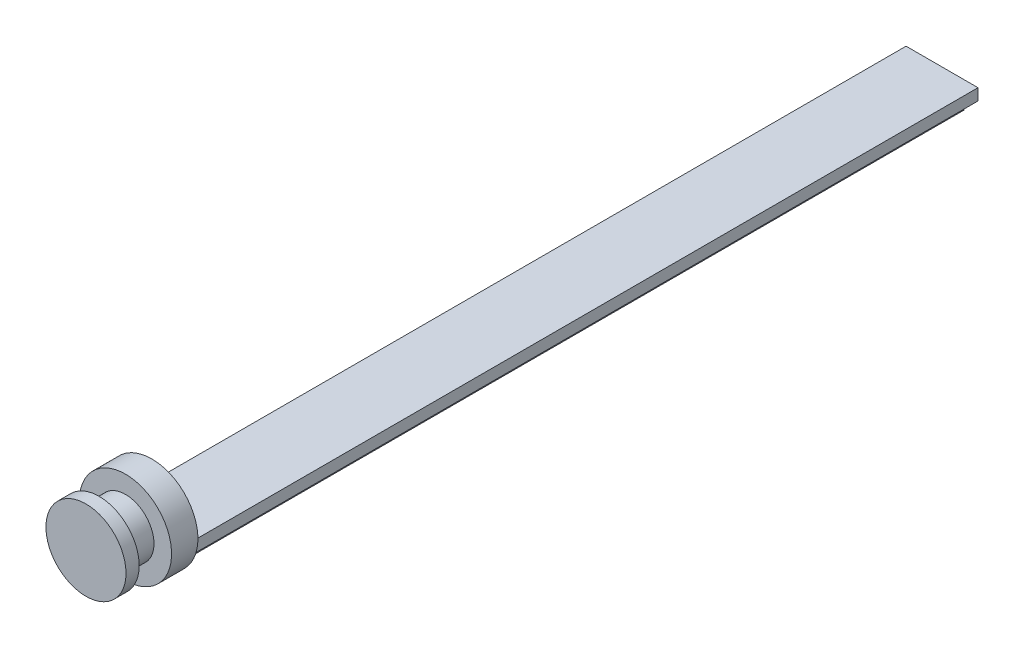
from build123d import *

# Parameters (mm, degrees)
CROQUIS1_R              = 4.56
SALIENTE_EXTRUIR4_DEPTH = 1.5
CROQUIS4_R              = 3.25
SALIENTE_EXTRUIR5_DEPTH = 3
CROQUIS5_R              = 5.25
SALIENTE_EXTRUIR6_DEPTH = 3
CROQUIS6_W              = 2.5
CROQUIS6_H              = 1.700541123
SALIENTE_EXTRUIR7_DEPTH = 90


with BuildPart() as part:
    # Croquis1 → Saliente-Extruir4 (new body)
    with BuildSketch(Plane.XY):
        Circle(CROQUIS1_R)
    extrude(amount=SALIENTE_EXTRUIR4_DEPTH)

    # Croquis4 → Saliente-Extruir5 (add)
    with BuildSketch(Plane(origin=(0, 0, 0), x_dir=(-1, 0, 0), z_dir=(0, 0, -1))):
        Circle(CROQUIS4_R)
    extrude(amount=SALIENTE_EXTRUIR5_DEPTH)

    # Croquis5 → Saliente-Extruir6 (add)
    with BuildSketch(Plane(origin=(0, 0, -3), x_dir=(-1, 0, 0), z_dir=(0, 0, -1))):
        Circle(CROQUIS5_R)
    extrude(amount=SALIENTE_EXTRUIR6_DEPTH)

    # Croquis6 → Saliente-Extruir7 (add)
    with BuildSketch(Plane(origin=(0, 0, -6), x_dir=(-1, 0, 0), z_dir=(0, 0, -1))):
        Polygon((0, -2.40164141), (0, -1.088943), (-4.096121931, -1.088943), (-4.096121931, -2.40164141), (-2.5, -2.40164141), align=None)
        Polygon((4.096121931, -1.088943), (0, -1.088943), (0, -2.40164141), (2.5, -2.40164141), (4.096121931, -2.40164141), align=None)
        with Locations((1.25, -3.251911972)):
            Rectangle(CROQUIS6_W, CROQUIS6_H)
        with Locations((-1.25, -3.251911972)):
            Rectangle(CROQUIS6_W, CROQUIS6_H)
    extrude(amount=SALIENTE_EXTRUIR7_DEPTH)


solid = part.part
